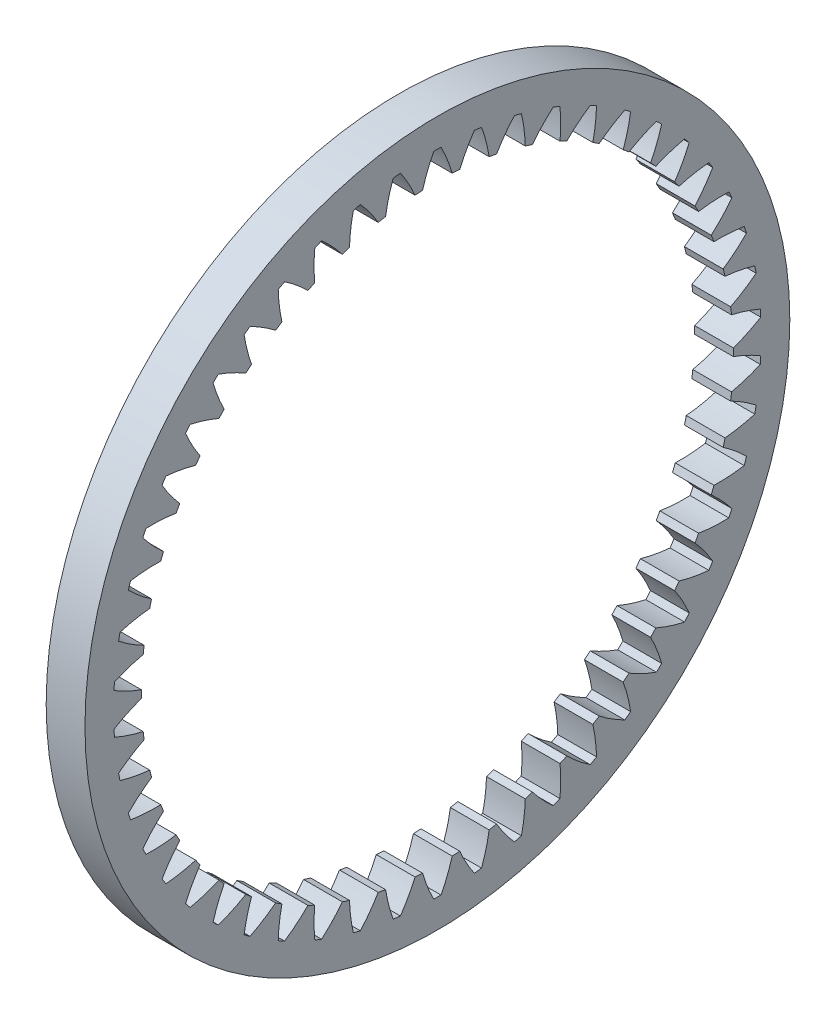
from build123d import *

# Parameters (mm, degrees)
BASPROSKE_W     = 5.5
BASPROSKE_H     = 8
TOOTHCUT_DEPTH  = 71.924255371
TEETHCUTS_COUNT = 50
TEETHCUTS_ANGLE = 352.8


with BuildPart() as part:
    # BasProSke → Base-Revolve (revolve)
    with BuildSketch(Plane(origin=(0, 0, 0), x_dir=(1, 0, 0), z_dir=(0, 1, 0)), mode=Mode.PRIVATE) as base_revolve_sk:
        with Locations((2.75, 46)):
            Rectangle(BASPROSKE_W, BASPROSKE_H)
    revolve(base_revolve_sk.sketch.rotate(Axis((-10, 0, 0), (1, 0, 0)), 180), axis=Axis((-10, 0, 0), (1, 0, 0)))

    # TooCutSke → ToothCut (cut, through all)
    with BuildSketch(Plane(origin=(0, 0, 0), x_dir=(0, 0, -1), z_dir=(1, 0, 0))):
        with BuildLine():
            ThreePointArc((2.110299685, 41.921518107), (1.411347172, 43.968081495), (0.513728436, 45.935627408))
            ThreePointArc((0.513728436, 45.935627408), (0, 45.9385), (-0.513728436, 45.935627408))
            ThreePointArc((-0.513728436, 45.935627408), (-1.411347172, 43.968081495), (-2.110299685, 41.921518107))
            ThreePointArc((-2.110299685, 41.921518107), (0, 41.9746), (2.110299685, 41.921518107))
        make_face()
    toothcut = extrude(amount=TOOTHCUT_DEPTH, mode=Mode.SUBTRACT)

    # TeethCuts: ToothCut ×50 about axis
    teethcuts_axis = Axis((-10, 0, 0), (1, 0, 0))
    for i in range(1, TEETHCUTS_COUNT):
        add(toothcut.rotate(teethcuts_axis, i * TEETHCUTS_ANGLE / (TEETHCUTS_COUNT - 1)), mode=Mode.SUBTRACT)


solid = part.part
